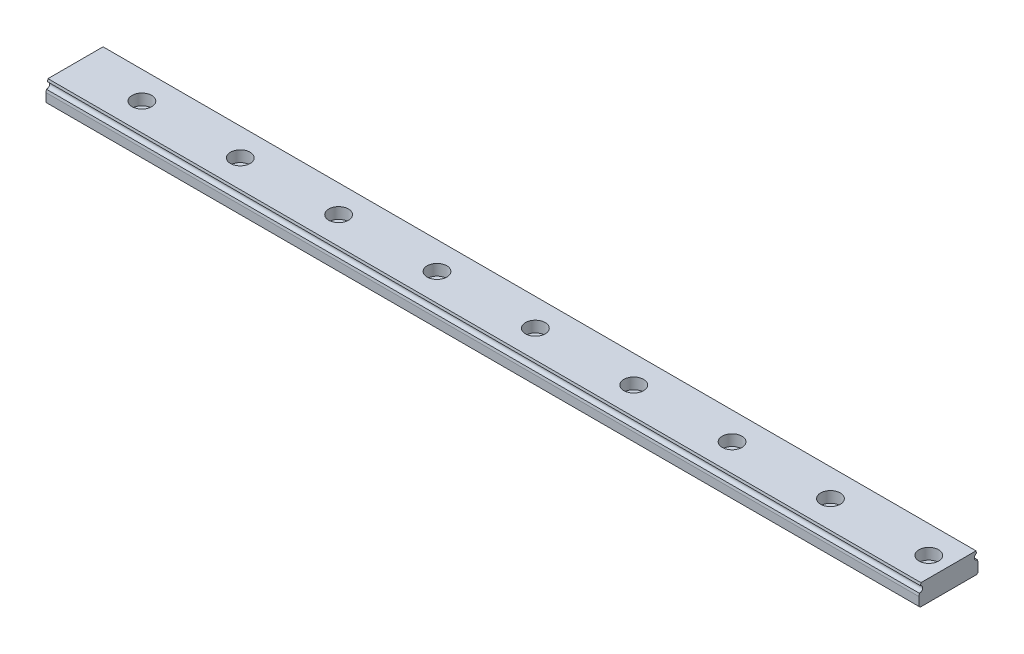
from build123d import *

# Parameters (mm, degrees)
RESSALTO_EXTRUS_O1_DEPTH      = 263
RESSALTO_EXTRUS_O1_DEPTH_BACK = 92
LPATTERN1_COUNT               = 6
LPATTERN1_PITCH               = 40
LPATTERN1_COL_COUNT           = 4
LPATTERN1_COL_PITCH           = 40


with BuildPart() as part:
    # Esboço1 → Ressalto-extrusão1 (new, two sides: drawn at the far end of the back side and taken through both)
    with BuildSketch(Plane(origin=(-15, 0, 0), x_dir=(0, 0, -1), z_dir=(1, 0, 0)).offset(-RESSALTO_EXTRUS_O1_DEPTH_BACK)):
        with BuildLine():
            Line((-12, 4), (-12, 0.5))
            Line((-12, 0.5), (-11.5, 0))
            Line((-11.5, 0), (11.5, 0))
            Line((11.5, 0), (12, 0.5))
            Line((12, 0.5), (12, 4))
            Line((12, 4), (11.814562479, 5.051668439))
            ThreePointArc((11.814562479, 5.051668439), (10.518990309, 6.082939778), (11.383714346, 7.495129625))
            Line((11.383714346, 7.495129625), (11.206528587, 8.5))
            Line((11.206528587, 8.5), (-11.206528587, 8.5))
            Line((-11.206528587, 8.5), (-11.383714346, 7.495129625))
            ThreePointArc((-11.383714346, 7.495129625), (-10.518990309, 6.082939778), (-11.814562479, 5.051668439))
            Line((-11.814562479, 5.051668439), (-12, 4))
        make_face()
    extrude(amount=RESSALTO_EXTRUS_O1_DEPTH + RESSALTO_EXTRUS_O1_DEPTH_BACK)

    # Esboço3 → Corte-Revolução2 (revolve, cut)
    with BuildSketch(Plane.XY, mode=Mode.PRIVATE) as corte_revolu_o2_sk:
        Polygon((40, 8.5), (44, 8.5), (44, 4), (42.25, 4), (42.25, 0), (40, 0), align=None)
    corte_revolu_o2 = revolve(corte_revolu_o2_sk.sketch.rotate(Axis((40, 0, 0), (0, 1, 0)), 270), axis=Axis((40, 0, 0), (0, 1, 0)), mode=Mode.SUBTRACT)

    # LPattern1: Corte-Revolução2 ×6
    with Locations(*[(i * LPATTERN1_PITCH, 0, 0) for i in range(1, LPATTERN1_COUNT)]):
        add(corte_revolu_o2, mode=Mode.SUBTRACT)

    # LPattern1 col: Corte-Revolução2 ×4
    with Locations(*[(-i * LPATTERN1_COL_PITCH, 0, 0) for i in range(1, LPATTERN1_COL_COUNT)]):
        add(corte_revolu_o2, mode=Mode.SUBTRACT)


solid = part.part
